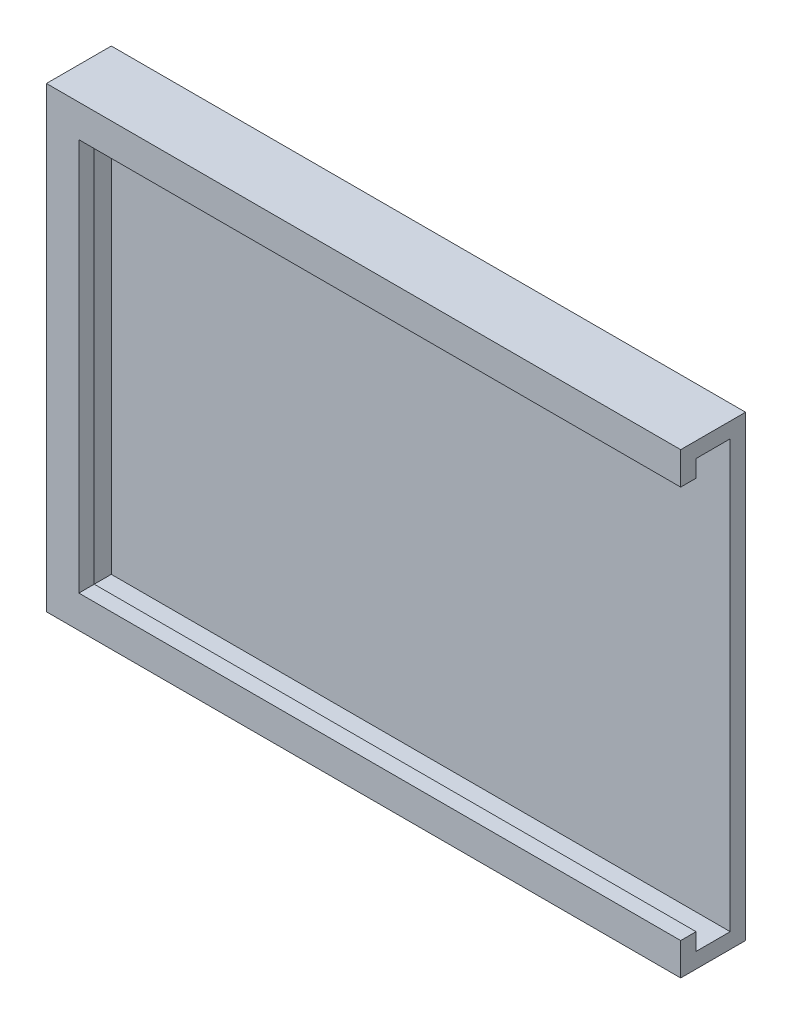
from build123d import *

# Parameters (mm, degrees)
SKETCH_1_W               = 72.5
SKETCH_1_H               = 50
EXTRUDE_1_DEPTH          = 4
SHELL_1_T                = 1.8
CUT_EXTRUDE_1_DEPTH      = 48.157210477
CUT_EXTRUDE_1_DEPTH_BACK = 4


with BuildPart() as part:
    # 草图1 → 凸台-拉伸1 (new body)
    with BuildSketch(Plane.XY):
        Rectangle(SKETCH_1_W, SKETCH_1_H)
    extrude(amount=EXTRUDE_1_DEPTH)

    # 抽壳1
    shell_1_openings = [part.faces().sort_by_distance(p)[0] for p in [
        (36.25, 0, 2),
    ]]
    offset(amount=SHELL_1_T, openings=shell_1_openings, kind=Kind.INTERSECTION)

    # 草图2 → 切除-拉伸1 (cut, two sides: drawn at the far end of the back side and taken through both)
    with BuildSketch(Plane.XY.offset(5.8).offset(-CUT_EXTRUDE_1_DEPTH_BACK)):
        Polygon((34.25, 23), (36.25, 23), (36.25, -23), (34.25, -23), (-34.25, -23), (-34.25, 23), align=None)
    extrude(amount=CUT_EXTRUDE_1_DEPTH + CUT_EXTRUDE_1_DEPTH_BACK, mode=Mode.SUBTRACT)


solid = part.part
